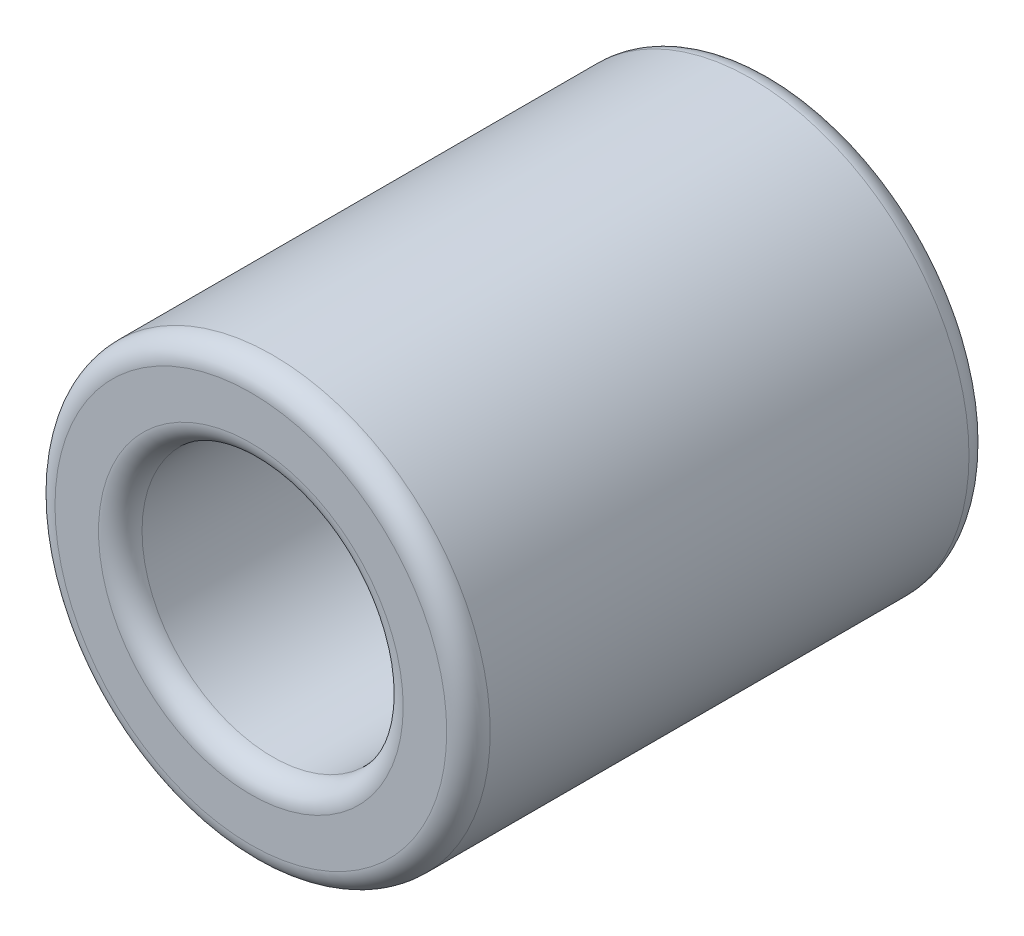
from build123d import *

# Parameters (mm, degrees)
SKETCH_1_R      = 5
SKETCH_1_R_2    = 3
EXTRUDE_1_DEPTH = 12
FILLET_1_R      = 0.5


with BuildPart() as part:
    # 草图1 → 凸台-拉伸1 (new body)
    with BuildSketch(Plane.XY):
        Circle(SKETCH_1_R)
        Circle(SKETCH_1_R_2, mode=Mode.SUBTRACT)
    extrude(amount=EXTRUDE_1_DEPTH)

    # 圆角1
    fillet_1_edges = [part.edges().sort_by_distance(p)[0] for p in [
        (-5, 0, 0),
        (-5, 0, 12),
        (-3, 0, 0),
        (-3, 0, 12),
    ]]
    fillet(fillet_1_edges, radius=FILLET_1_R)


solid = part.part
